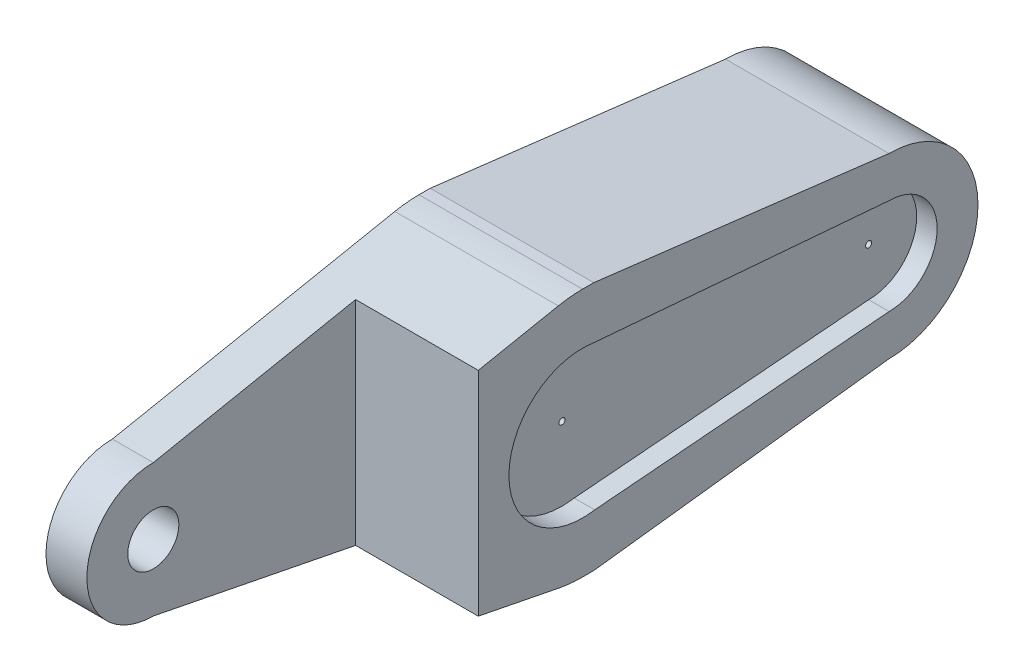
from build123d import *

# Parameters (mm, degrees)
SKETCH2_R           = 1.25
BOSS_EXTRUDE1_DEPTH = 8
BOSS_EXTRUDE2_DEPTH = 7
SKETCH3_R           = 0.15
CUT_EXTRUDE1_DEPTH  = 21.967832506
CUT_EXTRUDE2_START  = -6
SKETCH4_R           = 1.25
CUT_EXTRUDE2_DEPTH  = 6


with BuildPart() as part:
    # Sketch2 → Boss-Extrude1 (new body)
    with BuildSketch(Plane.YZ):
        with BuildLine():
            ThreePointArc((-4.35, -14.45), (-3.075914484, -17.525914513), (4.1e-08, -18.8))
            ThreePointArc((4.1e-08, -18.8), (3.075914513, -17.525914484), (4.35, -14.45))
            Line((4.35, -14.45), (6.1, 0))
            Line((6.1, 0), (6.1, 0.55))
            ThreePointArc((6.1, 0.55), (6.070921356, 1.144906627), (5.983962658, 1.734141424))
            Line((5.983962658, 1.734141424), (3.25, 15.55))
            ThreePointArc((3.25, 15.55), (2.298097039, 17.848097039), (0, 18.8))
            ThreePointArc((0, 18.8), (-2.298097039, 17.848097039), (-3.25, 15.55))
            Line((-3.25, 15.55), (-5.983962658, 1.734141424))
            ThreePointArc((-5.983962658, 1.734141424), (-6.070921356, 1.144906627), (-6.1, 0.55))
            Line((-6.1, 0.55), (-6.1, 0))
            Line((-6.1, 0), (-4.35, -14.45))
        make_face()
        with BuildLine():
            Line((3.550344828, -0.045862069), (2.35, -14.45))
            ThreePointArc((2.35, -14.45), (0, -16.8), (-2.35, -14.45))
            Line((-2.35, -14.45), (-3.550344828, -0.045862069))
            ThreePointArc((-3.550344828, -0.045862069), (-3.58756473, 0.251036273), (-3.6, 0.55))
            ThreePointArc((-3.6, 0.55), (0, 4.15), (3.6, 0.55))
            ThreePointArc((3.6, 0.55), (3.58756473, 0.251036273), (3.550344828, -0.045862069))
        make_face(mode=Mode.SUBTRACT)
        with Locations((0, 15.55)):
            Circle(SKETCH2_R, mode=Mode.SUBTRACT)
    extrude(amount=BOSS_EXTRUDE1_DEPTH)

    # Sketch2<3> → Boss-Extrude2 (add)
    with BuildSketch(Plane.YZ):
        with BuildLine():
            ThreePointArc((-2.35, -14.45), (0, -16.8), (2.35, -14.45))
            Line((2.35, -14.45), (3.550344828, -0.045862069))
            Line((3.550344828, -0.045862069), (3.6, 0.55))
            ThreePointArc((3.6, 0.55), (0, 4.15), (-3.6, 0.55))
            Line((-3.6, 0.55), (-3.550344828, -0.045862069))
            Line((-3.550344828, -0.045862069), (-2.35, -14.45))
        make_face()
    extrude(amount=BOSS_EXTRUDE2_DEPTH)

    # Sketch3 → Cut-Extrude1 (cut, through all)
    with BuildSketch(Plane.YZ.offset(7)):
        with Locations((0, 0.55)):
            Circle(SKETCH3_R)
        with Locations((0, -14.45)):
            Circle(SKETCH3_R)
    extrude(amount=-CUT_EXTRUDE1_DEPTH, mode=Mode.SUBTRACT)

    # Sketch4 → Cut-Extrude2 (cut)
    with BuildSketch(Plane.YZ.offset(8).offset(CUT_EXTRUDE2_START)):
        with BuildLine():
            Line((-5.209069729, 5.65), (5.209069729, 5.65))
            Line((5.209069729, 5.65), (3.25, 15.55))
            ThreePointArc((3.25, 15.55), (0, 18.8), (-3.25, 15.55))
            Line((-3.25, 15.55), (-5.209069729, 5.65))
        make_face()
        with Locations((0, 15.55)):
            Circle(SKETCH4_R, mode=Mode.SUBTRACT)
    extrude(amount=CUT_EXTRUDE2_DEPTH, mode=Mode.SUBTRACT)


solid = part.part
